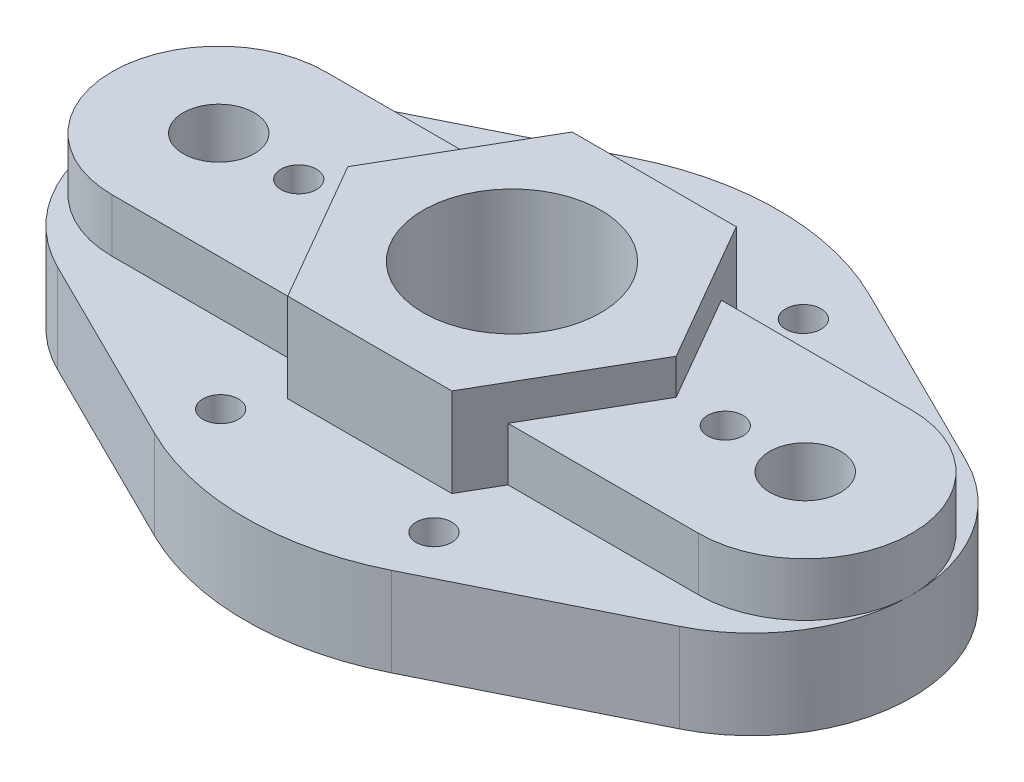
from build123d import *

# Parameters (mm, degrees)
EXTRUDE_1_DEPTH     = 10
EXTRUDE_1_2_DEPTH   = 10
EXTRUDE_2_DEPTH     = 16
EXTRUDE_3_DEPTH     = 20
SKETCH_3_R          = 10
SKETCH_3_R_2        = 4
SKETCH_3_R_3        = 2
CUT_EXTRUDE_1_DEPTH = 58.662812973


with BuildPart() as part:
    # 草图2 → 凸台-拉伸1 (new body)
    with BuildSketch(Plane(origin=(0, 0, 0), x_dir=(1, 0, 0), z_dir=(0, 1, 0))):
        with BuildLine():
            ThreePointArc((45, -7.2e-08), (42.29705856, 9.48683295), (35, 16.124515497))
            Line((35, 16.124515497), (13.333333333, 26.874192494))
            ThreePointArc((13.333333333, 26.874192494), (0, 30), (-13.333333333, 26.874192494))
            Line((-13.333333333, 26.874192494), (-35, 16.124515497))
            ThreePointArc((-35, 16.124515497), (-42.29705853, 9.486832997), (-45, 3.9e-08))
            ThreePointArc((-45, 3.9e-08), (-41.48528136, 8.485281388), (-33, 12))
            Line((-33, 12), (-11.547005384, 12))
            Line((-11.547005384, 12), (-9.237604307, 16))
            Line((-9.237604307, 16), (9.237604307, 16))
            Line((9.237604307, 16), (11.547005384, 12))
            Line((11.547005384, 12), (33, 12))
            ThreePointArc((33, 12), (41.4852814, 8.485281349), (45, -7.2e-08))
        make_face()
    extrude(amount=EXTRUDE_1_DEPTH)



with BuildPart() as body_2:
    # 草图2 → Extrude 1 2 (new body)
    with BuildSketch(Plane(origin=(0, 0, 0), x_dir=(1, 0, 0), z_dir=(0, 1, 0))):
        with BuildLine():
            ThreePointArc((35, -16.124515497), (42.297058522, -9.486833011), (45, -7.2e-08))
            ThreePointArc((45, -7.2e-08), (41.485281349, -8.4852814), (33, -12))
            Line((33, -12), (11.547005384, -12))
            Line((11.547005384, -12), (9.237604307, -16))
            Line((9.237604307, -16), (-9.237604307, -16))
            Line((-9.237604307, -16), (-11.547005384, -12))
            Line((-11.547005384, -12), (-33, -12))
            ThreePointArc((-33, -12), (-41.485281388, -8.48528136), (-45, 3.9e-08))
            ThreePointArc((-45, 3.9e-08), (-42.297058551, -9.486832964), (-35, -16.124515497))
            Line((-35, -16.124515497), (-13.333333333, -26.874192494))
            ThreePointArc((-13.333333333, -26.874192494), (0, -30), (13.333333333, -26.874192494))
            Line((13.333333333, -26.874192494), (35, -16.124515497))
        make_face()
    extrude(amount=EXTRUDE_1_2_DEPTH)


with BuildPart() as part_1:
    add(part.part)

    add(body_2.part)  # 凸台-拉伸2 merges body 2
    # 草图2<3> → 凸台-拉伸2 (add)
    with BuildSketch(Plane(origin=(0, 0, 0), x_dir=(1, 0, 0), z_dir=(0, 1, 0))):
        with BuildLine():
            ThreePointArc((33, -12), (45, 0), (33, 12))
            Line((33, 12), (11.547005384, 12))
            Line((11.547005384, 12), (18.475208614, 0))
            Line((18.475208614, 0), (11.547005384, -12))
            Line((11.547005384, -12), (33, -12))
        make_face()
        with BuildLine():
            ThreePointArc((-33, 12), (-45, 0), (-33, -12))
            Line((-33, -12), (-11.547005384, -12))
            Line((-11.547005384, -12), (-18.475208614, 0))
            Line((-18.475208614, 0), (-11.547005384, 12))
            Line((-11.547005384, 12), (-33, 12))
        make_face()
    extrude(amount=EXTRUDE_2_DEPTH)

    # 草图2<4> → 凸台-拉伸3 (add)
    with BuildSketch(Plane(origin=(0, 0, 0), x_dir=(1, 0, 0), z_dir=(0, 1, 0))):
        Polygon((9.237604307, -16), (18.475208614, 0), (9.237604307, 16), (-9.237604307, 16), (-18.475208614, 0), (-9.237604307, -16), align=None)
    extrude(amount=EXTRUDE_3_DEPTH)

    # 草图3 → 切除-拉伸1 (cut, through all)
    with BuildSketch(Plane(origin=(0, 20, 0), x_dir=(1, 0, 0), z_dir=(0, 1, 0))):
        Circle(SKETCH_3_R)
        with Locations((33, 0)):
            Circle(SKETCH_3_R_2)
        with Locations((-33, 0)):
            Circle(SKETCH_3_R_2)
        with Locations((24, 0)):
            Circle(SKETCH_3_R_3)
        with Locations((12, -20.784609691)):
            Circle(SKETCH_3_R_3)
        with Locations((-12, -20.784609691)):
            Circle(SKETCH_3_R_3)
        with Locations((-24, 0)):
            Circle(SKETCH_3_R_3)
        with Locations((-12, 20.784609691)):
            Circle(SKETCH_3_R_3)
        with Locations((12, 20.784609691)):
            Circle(SKETCH_3_R_3)
    extrude(amount=-CUT_EXTRUDE_1_DEPTH, mode=Mode.SUBTRACT)


solid = part_1.part
